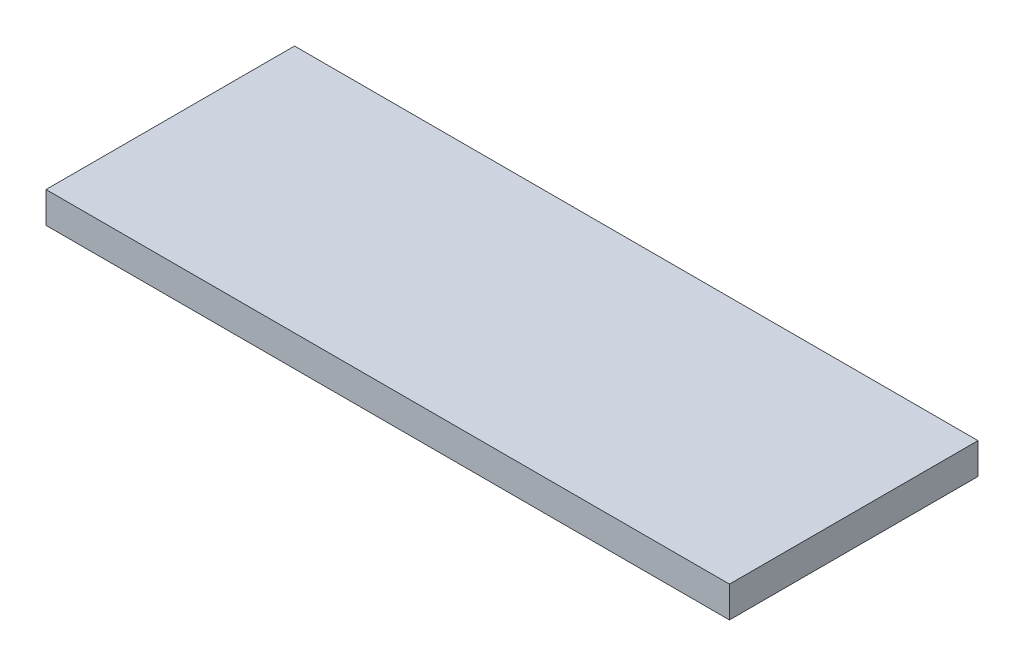
from build123d import *

# Parameters (mm, degrees)
SKETCH1_W           = 22
SKETCH1_H           = 8
BOSS_EXTRUDE1_DEPTH = 1


with BuildPart() as part:
    # Sketch1 → Boss-Extrude1 (new body)
    with BuildSketch(Plane(origin=(0, 0, 0), x_dir=(1, 0, 0), z_dir=(0, 1, 0))):
        with Locations((11, 4)):
            Rectangle(SKETCH1_W, SKETCH1_H)
    extrude(amount=BOSS_EXTRUDE1_DEPTH)


solid = part.part
